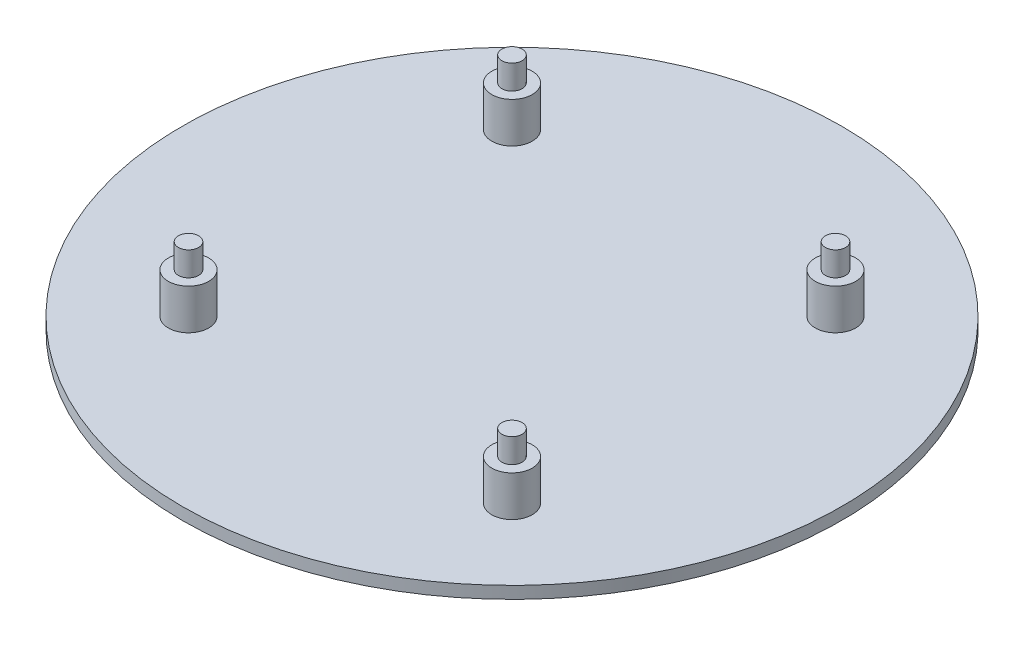
from build123d import *

# Parameters (mm, degrees)
SKETCH3_R           = 81.5
BOSS_EXTRUDE1_DEPTH = 3
SKETCH4_R           = 5
BOSS_EXTRUDE2_DEPTH = 10
SKETCH5_R           = 2.5
BOSS_EXTRUDE3_DEPTH = 6


with BuildPart() as part:
    # Sketch3 → Boss-Extrude1 (new body)
    with BuildSketch(Plane(origin=(0, 0, 0), x_dir=(1, 0, 0), z_dir=(0, 1, 0))):
        with Locations(Location((0, 0, 0), (0, 0, 270))):
            Circle(SKETCH3_R)
    extrude(amount=BOSS_EXTRUDE1_DEPTH)

    # Sketch4 → Boss-Extrude2 (add)
    with BuildSketch(Plane(origin=(0, 3, 0), x_dir=(1, 0, 0), z_dir=(0, 1, 0))):
        with Locations(Location((-40, 40, 0), (0, 0, 270))):
            Circle(SKETCH4_R)
        with Locations(Location((40, 40, 0), (0, 0, 90))):
            Circle(SKETCH4_R)
        with Locations(Location((40, -40, 0), (0, 0, 270))):
            Circle(SKETCH4_R)
        with Locations(Location((-40, -40, 0), (0, 0, 90))):
            Circle(SKETCH4_R)
    extrude(amount=BOSS_EXTRUDE2_DEPTH)

    # Sketch5 → Boss-Extrude3 (add)
    with BuildSketch(Plane(origin=(0, 13, 0), x_dir=(1, 0, 0), z_dir=(0, 1, 0))):
        with Locations(Location((-40, 40, 0), (0, 0, 270))):
            Circle(SKETCH5_R)
        with Locations(Location((40, 40, 0), (0, 0, 90))):
            Circle(SKETCH5_R)
        with Locations(Location((40, -40, 0), (0, 0, 270))):
            Circle(SKETCH5_R)
        with Locations(Location((-40, -40, 0), (0, 0, 90))):
            Circle(SKETCH5_R)
    extrude(amount=BOSS_EXTRUDE3_DEPTH)


solid = part.part
